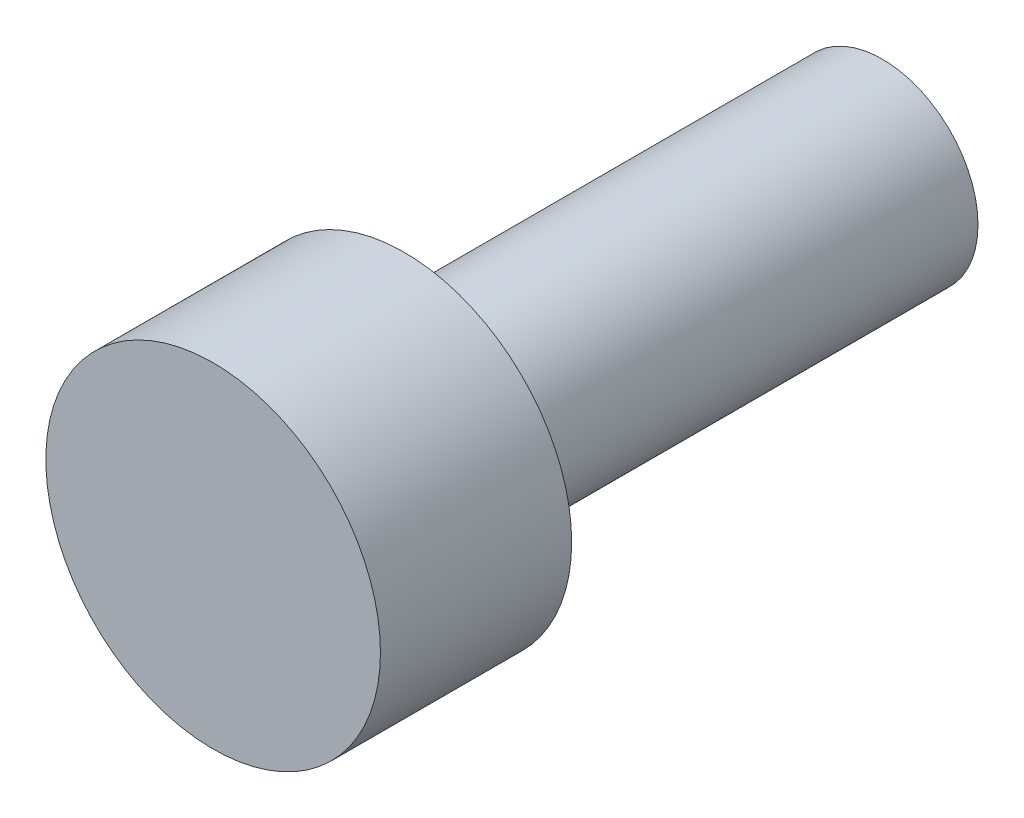
from build123d import *

# Parameters (mm, degrees)
NOMINAL_SHANK_START    = -10
SKETCH_NOMINAL_SHANK_R = 2
NOMINAL_SHANK_DEPTH    = 10
SKETCH_HEAD_R          = 3.5
HEAD_DEPTH             = 4


with BuildPart() as part:
    # Sketch_Nominal_shank → Nominal_shank (new body)
    with BuildSketch(Plane.XY.offset(NOMINAL_SHANK_START)):
        Circle(SKETCH_NOMINAL_SHANK_R)
    extrude(amount=NOMINAL_SHANK_DEPTH)

    # Sketch_Head → Head (add)
    with BuildSketch(Plane.XY):
        Circle(SKETCH_HEAD_R)
    extrude(amount=HEAD_DEPTH)


solid = part.part
